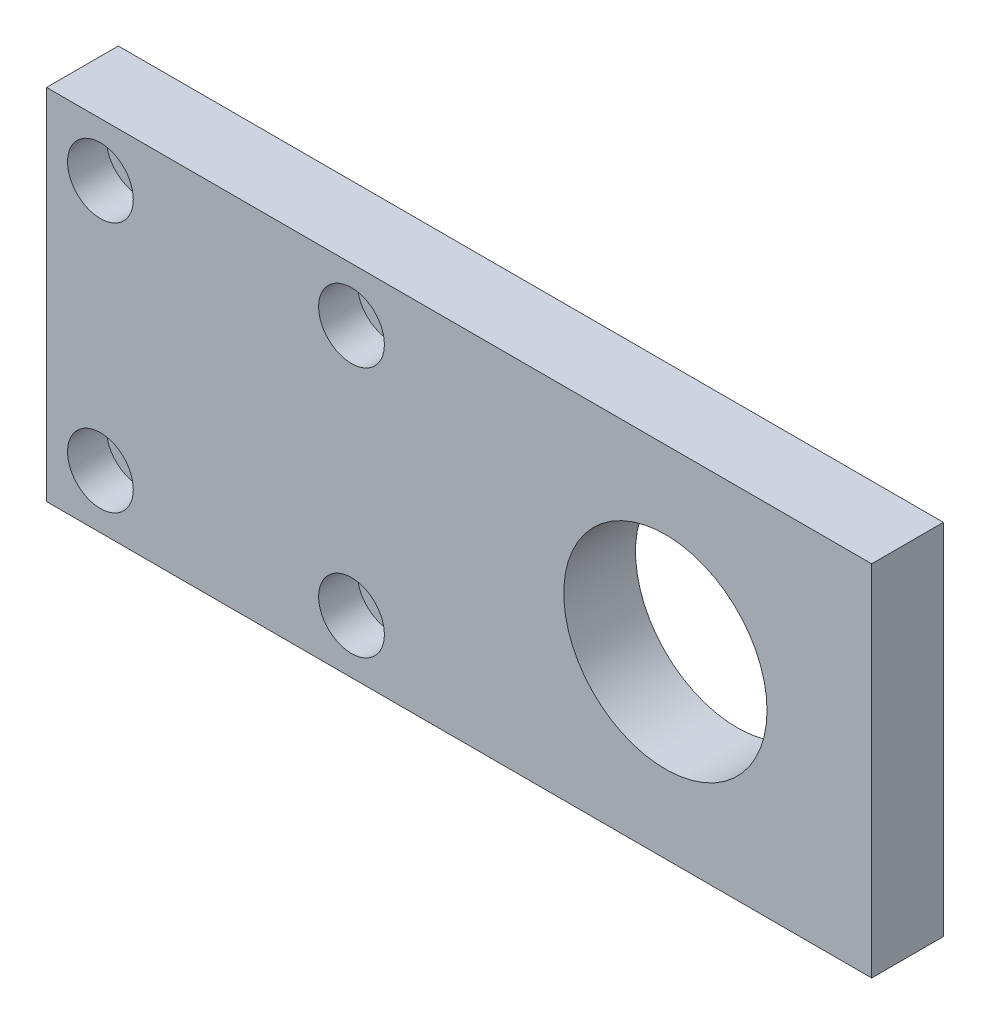
from build123d import *

# Parameters (mm, degrees)
SZKIC1_W                                             = 138
SZKIC1_H                                             = 60
SZKIC1_R                                             = 17
DODANIE_WYCI_GNI_CIE1_DEPTH                          = 12
POG_BIENIE_WALCOWE_POD_M5_WKR_T_DO_CZ_CI_D           = 5.5
POG_BIENIE_WALCOWE_POD_M5_WKR_T_DO_CZ_CI_CBORE_D     = 11
POG_BIENIE_WALCOWE_POD_M5_WKR_T_DO_CZ_CI_CBORE_DEPTH = 6.5


with BuildPart() as part:
    # Szkic1 → Dodanie-wyciągnięcie1 (new body)
    with BuildSketch(Plane.XY):
        with Locations((-1, 330)):
            Rectangle(SZKIC1_W, SZKIC1_H)
        with Locations((33.5, 330)):
            Circle(SZKIC1_R, mode=Mode.SUBTRACT)
    extrude(amount=DODANIE_WYCI_GNI_CIE1_DEPTH)

    # Pogłębienie walcowe pod M5 Wkręt do części metalowych z łbem sześciokątnym1 (through all)
    with Locations(Plane.XY.offset(12)):
        with Locations((-61, 351), (-19, 351), (-61, 309), (-19, 309)):
            CounterBoreHole(POG_BIENIE_WALCOWE_POD_M5_WKR_T_DO_CZ_CI_D / 2, POG_BIENIE_WALCOWE_POD_M5_WKR_T_DO_CZ_CI_CBORE_D / 2, POG_BIENIE_WALCOWE_POD_M5_WKR_T_DO_CZ_CI_CBORE_DEPTH)


solid = part.part
